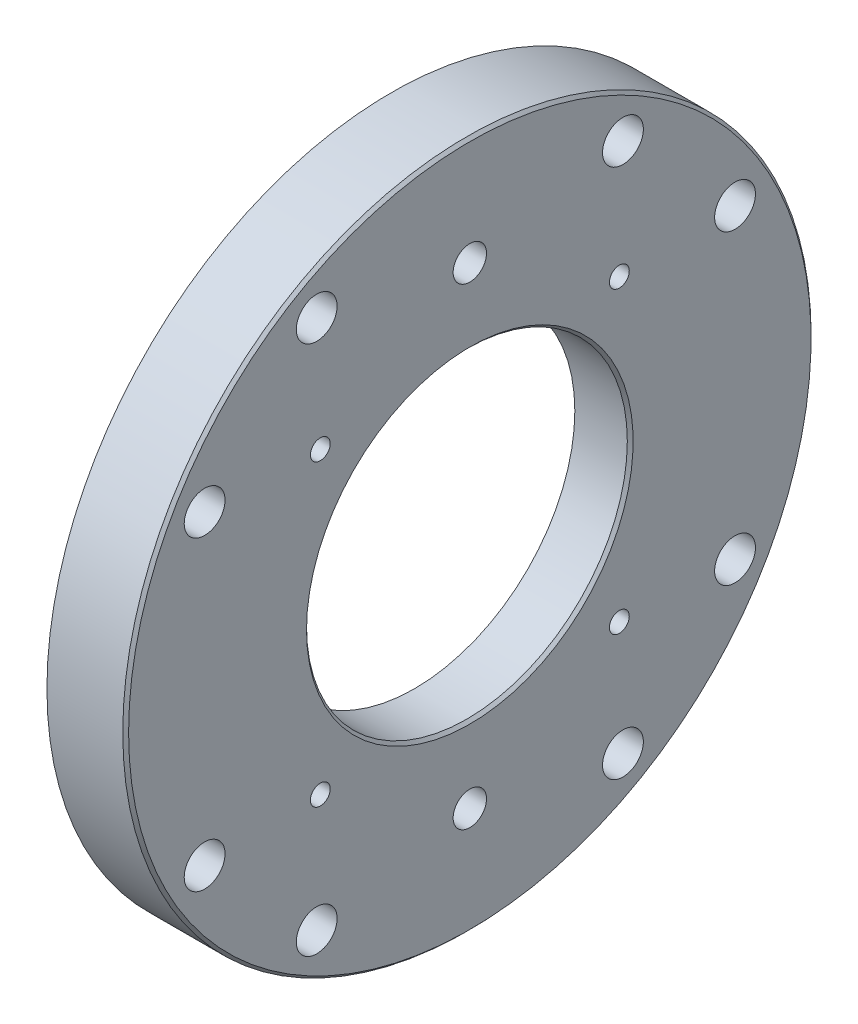
from build123d import *

# Parameters (mm, degrees)
CUT_EXTRUDE_1_DEPTH      = 170.04733065
CUT_EXTRUDE_1_DEPTH_BACK = 170.04733065
SKETCH_2_R               = 7
CUT_EXTRUDE_2_DEPTH      = 170.04733065
CUT_EXTRUDE_2_DEPTH_BACK = 170.04733065
SKETCH_3_R               = 3.4
CUT_EXTRUDE_3_DEPTH      = 170.04733065
CUT_EXTRUDE_3_DEPTH_BACK = 170.04733065
SKETCH_4_R               = 5.7225


with BuildPart() as part:
    # ｽｹｯﾁ1 → 回転1 (revolve)
    with BuildSketch(Plane.XY, mode=Mode.PRIVATE) as revolve_1_sk:
        Polygon((0, 117), (0, 56), (-1, 55), (-19, 55), (-19, 88), (-24, 88), (-24, 115), (-26.5, 115), (-27, 115.5), (-27, 118), (-1, 118), align=None)
    revolve(revolve_1_sk.sketch.rotate(Axis((-27, 0, 0), (1, 0, 0)), 90), axis=Axis((-27, 0, 0), (1, 0, 0)))

    # ｽｹｯﾁ2 → ｶｯﾄ - 押し出し1 (cut, two sides: drawn at the far end of the back side and taken through both)
    with BuildSketch(Plane(origin=(0, 0, 0), x_dir=(0, 0, -1), z_dir=(1, 0, 0)).offset(-CUT_EXTRUDE_1_DEPTH_BACK)):
        with Locations((90.932667397, 52.5)):
            Circle(SKETCH_2_R)
        with Locations((52.5, 90.932667397)):
            Circle(SKETCH_2_R)
        with Locations((-52.5, 90.932667397)):
            Circle(SKETCH_2_R)
        with Locations((-90.932667397, 52.5)):
            Circle(SKETCH_2_R)
        with Locations((-90.932667397, -52.5)):
            Circle(SKETCH_2_R)
        with Locations((-52.5, -90.932667397)):
            Circle(SKETCH_2_R)
        with Locations((52.5, -90.932667397)):
            Circle(SKETCH_2_R)
        with Locations((90.932667397, -52.5)):
            Circle(SKETCH_2_R)
    extrude(amount=CUT_EXTRUDE_1_DEPTH + CUT_EXTRUDE_1_DEPTH_BACK, mode=Mode.SUBTRACT)

    # ｽｹｯﾁ3 → ｶｯﾄ - 押し出し2 (cut, two sides: drawn at the far end of the back side and taken through both)
    with BuildSketch(Plane(origin=(0, 0, 0), x_dir=(0, 0, -1), z_dir=(1, 0, 0)).offset(-CUT_EXTRUDE_2_DEPTH_BACK)):
        with Locations((51.265241636, 51.265241636)):
            Circle(SKETCH_3_R)
        with Locations((-51.265241636, 51.265241636)):
            Circle(SKETCH_3_R)
        with Locations((-51.265241636, -51.265241636)):
            Circle(SKETCH_3_R)
        with Locations((51.265241636, -51.265241636)):
            Circle(SKETCH_3_R)
    extrude(amount=CUT_EXTRUDE_2_DEPTH + CUT_EXTRUDE_2_DEPTH_BACK, mode=Mode.SUBTRACT)

    # ｽｹｯﾁ4 → ｶｯﾄ - 押し出し3 (cut, two sides: drawn at the far end of the back side and taken through both)
    with BuildSketch(Plane(origin=(0, 0, 0), x_dir=(0, 0, -1), z_dir=(1, 0, 0)).offset(-CUT_EXTRUDE_3_DEPTH_BACK)):
        with Locations((0, 81)):
            Circle(SKETCH_4_R)
        with Locations((0, -81)):
            Circle(SKETCH_4_R)
    extrude(amount=CUT_EXTRUDE_3_DEPTH + CUT_EXTRUDE_3_DEPTH_BACK, mode=Mode.SUBTRACT)


solid = part.part
